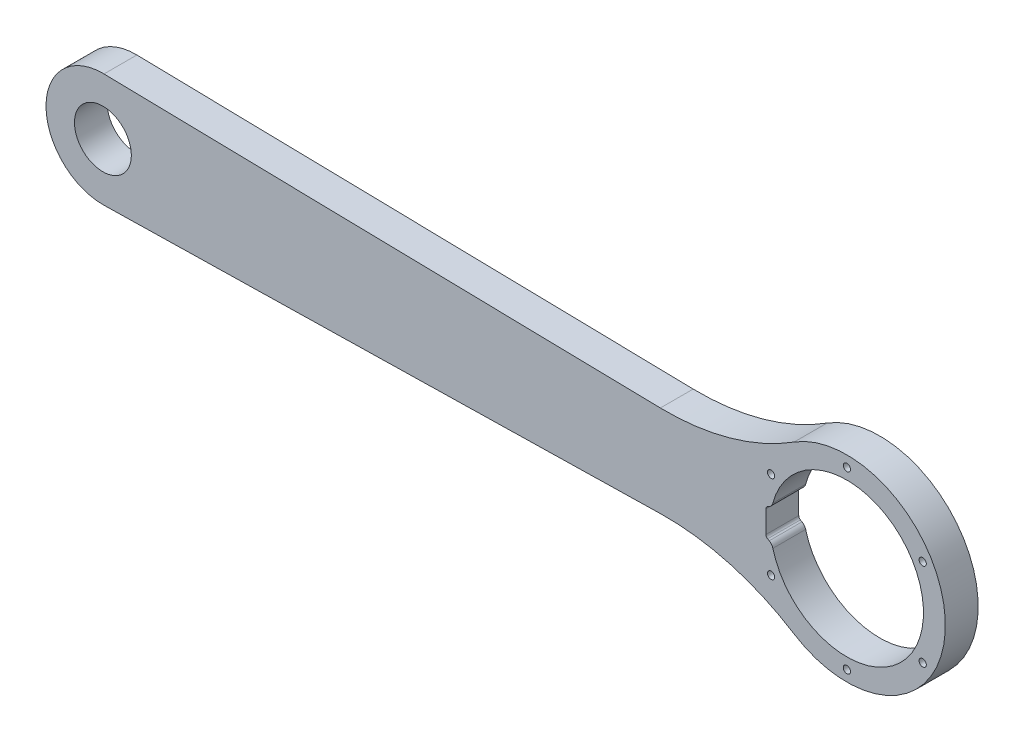
from build123d import *

# Parameters (mm, degrees)
SKETCH_1_R      = 1.65
SKETCH_1_R_2    = 13
EXTRUDE_1_DEPTH = 15


with BuildPart() as part:
    # 草图1 → 凸台-拉伸1 (new body)
    with BuildSketch(Plane.XY):
        with BuildLine():
            Line((-85.245113537, 20.900392521), (-339.479111624, 25.994781694))
            ThreePointArc((-339.479111624, 25.994781694), (-366, 0), (-339.479111624, -25.994781694))
            Line((-339.479111624, -25.994781694), (-85.245113537, -20.900392521))
            ThreePointArc((-85.245113537, -20.900392521), (-53.416829007, -24.942544633), (-24.108780491, -37.996930182))
            ThreePointArc((-24.108780491, -37.996930182), (45, 0), (-24.108780491, 37.996930182))
            ThreePointArc((-24.108780491, 37.996930182), (-53.416829007, 24.942544633), (-85.245113537, 20.900392521))
        make_face()
        with Locations((0, 40)):
            Circle(SKETCH_1_R, mode=Mode.SUBTRACT)
        with Locations((34.641016151, 20)):
            Circle(SKETCH_1_R, mode=Mode.SUBTRACT)
        with Locations((34.641016151, -20)):
            Circle(SKETCH_1_R, mode=Mode.SUBTRACT)
        with Locations((0, -40)):
            Circle(SKETCH_1_R, mode=Mode.SUBTRACT)
        with Locations((-34.641016151, 20)):
            Circle(SKETCH_1_R, mode=Mode.SUBTRACT)
        with Locations((-34.641016151, -20)):
            Circle(SKETCH_1_R, mode=Mode.SUBTRACT)
        with Locations((-340, 0)):
            Circle(SKETCH_1_R_2, mode=Mode.SUBTRACT)
        with BuildLine():
            Line((-35.500051413, 6.790401018), (-36.237951224, 6.373427606))
            ThreePointArc((-36.237951224, 6.373427606), (-36.795555255, 5.823507629), (-37, 5.067507244))
            Line((-37, 5.067507244), (-37, -5.067507244))
            ThreePointArc((-37, -5.067507244), (-36.795555255, -5.823507629), (-36.237951224, -6.373427606))
            Line((-36.237951224, -6.373427606), (-35.500051413, -6.790401018))
            ThreePointArc((-35.500051413, -6.790401018), (-34.451431588, -7.698788042), (-33.838125094, -8.943225935))
            ThreePointArc((-33.838125094, -8.943225935), (35, 0), (-33.838125094, 8.943225935))
            ThreePointArc((-33.838125094, 8.943225935), (-34.451431588, 7.698788042), (-35.500051413, 6.790401018))
        make_face(mode=Mode.SUBTRACT)
    extrude(amount=EXTRUDE_1_DEPTH)


solid = part.part
